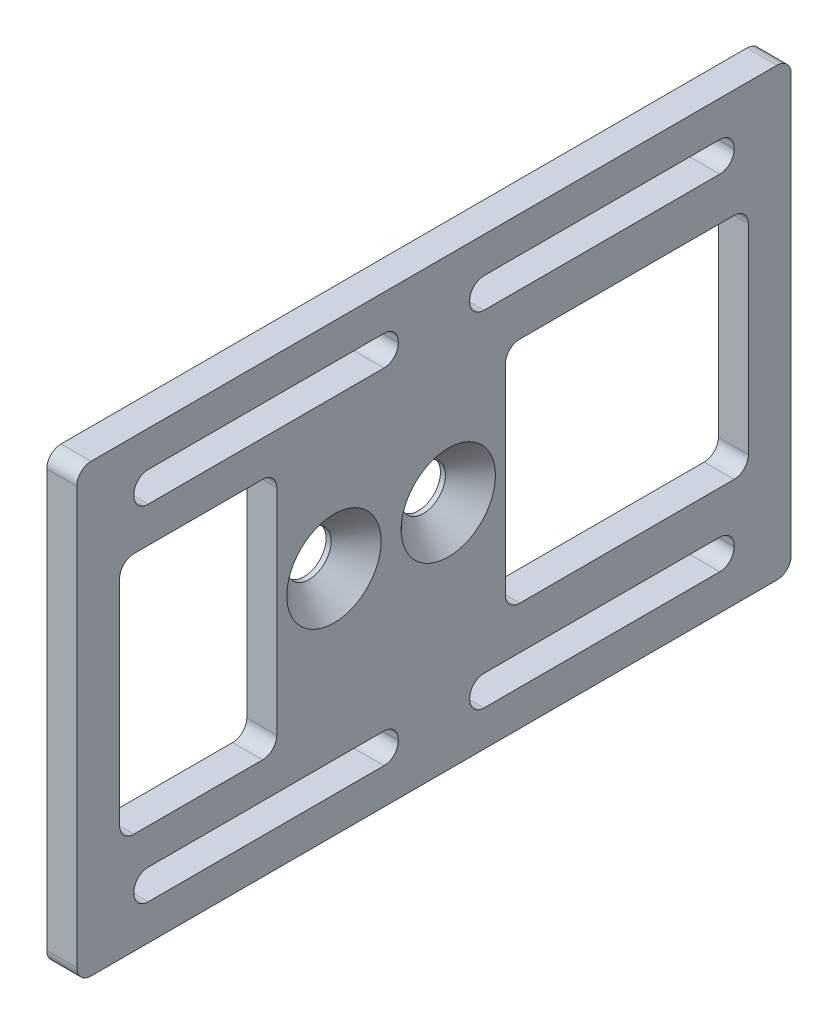
from build123d import *

# Parameters (mm, degrees)
SKETCH_1_W               = 50
SKETCH_1_H               = 31.2
SKETCH_1_R               = 1.55
SKETCH_1_W_2             = 18.5
SKETCH_1_H_2             = 2.1
SKETCH_1_W_3             = 17
SKETCH_1_H_3             = 16
SKETCH_1_W_4             = 11
SKETCH_1_H_4             = 17
EXTRUDE_1_DEPTH          = 2.1
HOLE_WIZARD_1_AT_2_COUNT = 2
HOLE_WIZARD_1_AT_2_PITCH = 8
FILLET_1_R               = 1


with BuildPart() as part:
    # 草图1 → 凸台-拉伸1 (new body)
    with BuildSketch(Plane(origin=(0, 0, 0), x_dir=(0, 0, -1), z_dir=(1, 0, 0))):
        with Locations((7, -0.6)):
            Rectangle(SKETCH_1_W, SKETCH_1_H)
        Circle(SKETCH_1_R, mode=Mode.SUBTRACT)
        with Locations((8, 0)):
            Circle(SKETCH_1_R, mode=Mode.SUBTRACT)
        with Locations((-4.75, 11.45)):
            Rectangle(SKETCH_1_W_2, SKETCH_1_H_2, mode=Mode.SUBTRACT)
        with Locations((18.75, 11.45)):
            Rectangle(SKETCH_1_W_2, SKETCH_1_H_2, mode=Mode.SUBTRACT)
        with Locations((18.75, -12.65)):
            Rectangle(SKETCH_1_W_2, SKETCH_1_H_2, mode=Mode.SUBTRACT)
        with Locations((-4.75, -12.65)):
            Rectangle(SKETCH_1_W_2, SKETCH_1_H_2, mode=Mode.SUBTRACT)
        with Locations((20.5, -0.6)):
            Rectangle(SKETCH_1_W_3, SKETCH_1_H_3, mode=Mode.SUBTRACT)
        with Locations((-9.5, -0.6)):
            Rectangle(SKETCH_1_W_4, SKETCH_1_H_4, mode=Mode.SUBTRACT)
    extrude(amount=EXTRUDE_1_DEPTH)

    # 草图2 → 打孔尺寸(%根据十字)槽沉头木螺钉的类型1 (revolve, cut)
    with BuildSketch(Plane(origin=(2.1, 0, 0), x_dir=(0, 0, -1), z_dir=(0, 1, 0))):
        Polygon((0, 0), (0, 2.1), (1.55, 2.1), (1.55, 1.75), (3.3, 0), align=None)
    hole_wizard_1 = revolve(axis=Axis((8.45, 0, 0), (-1, 0, 0)), mode=Mode.SUBTRACT)

    # 打孔尺寸(%根据十字)槽沉头木螺钉的类型1 at 2: 打孔尺寸(%根据十字)槽沉头木螺钉的类型1 ×2
    with Locations(*[(0, 0, -i * HOLE_WIZARD_1_AT_2_PITCH) for i in range(1, HOLE_WIZARD_1_AT_2_COUNT)]):
        add(hole_wizard_1, mode=Mode.SUBTRACT)

    # 圆角1
    fillet_1_edges = [part.edges().sort_by_distance(p)[0] for p in [
        (1.05, 12.5, 14),
        (1.05, 10.4, 14),
        (1.05, 10.4, -4.5),
        (1.05, 12.5, -4.5),
        (1.05, 12.5, -9.5),
        (1.05, 10.4, -9.5),
        (1.05, 10.4, -28),
        (1.05, 12.5, -28),
        (1.05, -11.6, -28),
        (1.05, -11.6, -9.5),
        (1.05, -13.7, -9.5),
        (1.05, -13.7, -28),
        (1.05, -13.7, -4.5),
        (1.05, -11.6, -4.5),
        (1.05, -11.6, 14),
        (1.05, -13.7, 14),
        (1.05, 15, 18),
        (1.05, 7.4, -12),
        (1.05, 15, -32),
        (1.05, -8.6, -12),
        (1.05, -8.6, -29),
        (1.05, 7.4, -29),
        (1.05, -16.2, -32),
        (1.05, -16.2, 18),
        (1.05, 7.9, 15),
        (1.05, -9.1, 15),
        (1.05, -9.1, 4),
        (1.05, 7.9, 4),
    ]]
    fillet(fillet_1_edges, radius=FILLET_1_R)


solid = part.part
